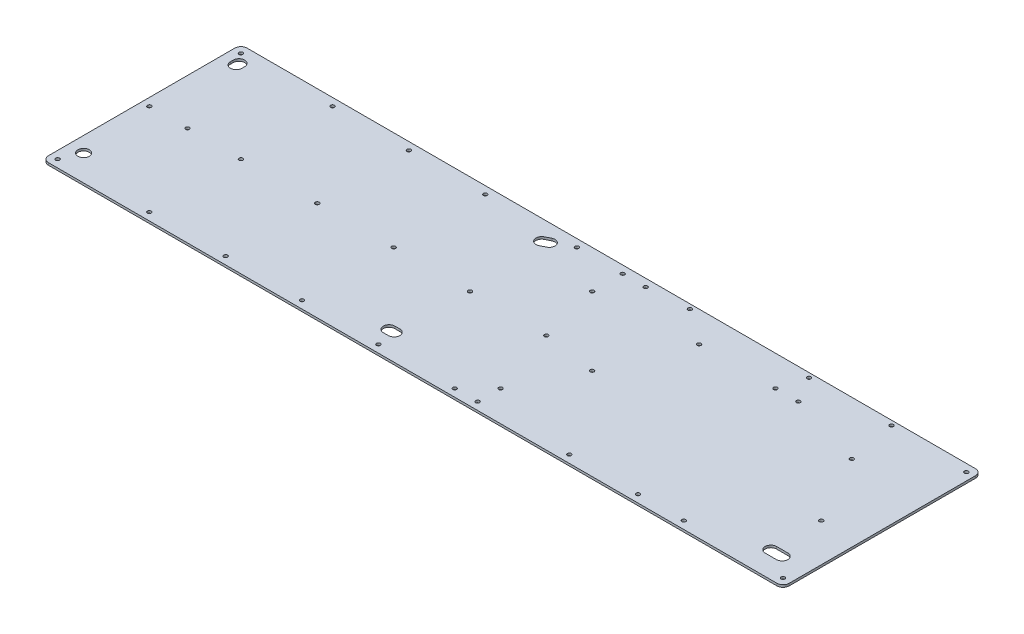
from build123d import *

# Parameters (mm, degrees)
BOSS_EXTRUDE1_START = -4
SKETCH1_W           = 485
SKETCH1_H           = 130
SKETCH1_R           = 1.25
SKETCH1_R_2         = 3.75
BOSS_EXTRUDE1_DEPTH = 1.5
FILLET1_R           = 4


with BuildPart() as part:
    # Sketch1 → Boss-Extrude1 (new body)
    with BuildSketch(Plane(origin=(0, 0, 0), x_dir=(1, 0, 0), z_dir=(0, 1, 0)).offset(BOSS_EXTRUDE1_START)):
        with Locations((242.5, 65)):
            Rectangle(SKETCH1_W, SKETCH1_H)
        with Locations(Location((5, 125, 0), (0, 0, 270))):
            Circle(SKETCH1_R, mode=Mode.SUBTRACT)
        with Locations(Location((65, 125, 0), (0, 0, 270))):
            Circle(SKETCH1_R, mode=Mode.SUBTRACT)
        with Locations(Location((5, 65, 0), (0, 0, 270))):
            Circle(SKETCH1_R, mode=Mode.SUBTRACT)
        with Locations(Location((30, 65, 0), (0, 0, 270))):
            Circle(SKETCH1_R, mode=Mode.SUBTRACT)
        with Locations(Location((65, 65, 0), (0, 0, 270))):
            Circle(SKETCH1_R, mode=Mode.SUBTRACT)
        with Locations(Location((115, 125, 0), (0, 0, 270))):
            Circle(SKETCH1_R, mode=Mode.SUBTRACT)
        with Locations(Location((115, 65, 0), (0, 0, 270))):
            Circle(SKETCH1_R, mode=Mode.SUBTRACT)
        with Locations(Location((5, 5, 0), (0, 0, 270))):
            Circle(SKETCH1_R, mode=Mode.SUBTRACT)
        with Locations(Location((65, 5, 0), (0, 0, 270))):
            Circle(SKETCH1_R, mode=Mode.SUBTRACT)
        with Locations(Location((115, 5, 0), (0, 0, 270))):
            Circle(SKETCH1_R, mode=Mode.SUBTRACT)
        with Locations(Location((165, 5, 0), (0, 0, 270))):
            Circle(SKETCH1_R, mode=Mode.SUBTRACT)
        with Locations(Location((215, 5, 0), (0, 0, 270))):
            Circle(SKETCH1_R, mode=Mode.SUBTRACT)
        with Locations(Location((265, 5, 0), (0, 0, 270))):
            Circle(SKETCH1_R, mode=Mode.SUBTRACT)
        with Locations(Location((280, 5, 0), (0, 0, 270))):
            Circle(SKETCH1_R, mode=Mode.SUBTRACT)
        with Locations(Location((280, 20, 0), (0, 0, 270))):
            Circle(SKETCH1_R, mode=Mode.SUBTRACT)
        with Locations(Location((415, 5, 0), (0, 0, 270))):
            Circle(SKETCH1_R, mode=Mode.SUBTRACT)
        with Locations(Location((385, 5, 0), (0, 0, 270))):
            Circle(SKETCH1_R, mode=Mode.SUBTRACT)
        with Locations(Location((339.996937627, 5, 0), (0, 0, 270))):
            Circle(SKETCH1_R, mode=Mode.SUBTRACT)
        with Locations(Location((480, 5, 0), (0, 0, 270))):
            Circle(SKETCH1_R, mode=Mode.SUBTRACT)
        with Locations(Location((460, 50, 0), (0, 0, 270))):
            Circle(SKETCH1_R, mode=Mode.SUBTRACT)
        with Locations(Location((435, 95, 0), (0, 0, 270))):
            Circle(SKETCH1_R, mode=Mode.SUBTRACT)
        with Locations(Location((369.997825764, 110.029448802, 0), (0, 0, 270))):
            Circle(SKETCH1_R, mode=Mode.SUBTRACT)
        with Locations(Location((385, 110.029448802, 0), (0, 0, 270))):
            Circle(SKETCH1_R, mode=Mode.SUBTRACT)
        with Locations(Location((480, 125, 0), (0, 0, 270))):
            Circle(SKETCH1_R, mode=Mode.SUBTRACT)
        with Locations(Location((429, 127, 0), (0, 0, 270))):
            Circle(SKETCH1_R, mode=Mode.SUBTRACT)
        with Locations(Location((374.95, 127, 0), (0, 0, 270))):
            Circle(SKETCH1_R, mode=Mode.SUBTRACT)
        with Locations(Location((300, 60, 0), (0, 0, 270))):
            Circle(SKETCH1_R, mode=Mode.SUBTRACT)
        with Locations(Location((265, 65, 0), (0, 0, 270))):
            Circle(SKETCH1_R, mode=Mode.SUBTRACT)
        with Locations(Location((255, 105, 0), (0, 0, 270))):
            Circle(SKETCH1_R, mode=Mode.SUBTRACT)
        with Locations(Location((320, 110, 0), (0, 0, 270))):
            Circle(SKETCH1_R, mode=Mode.SUBTRACT)
        with Locations(Location((297, 127, 0), (0, 0, 270))):
            Circle(SKETCH1_R, mode=Mode.SUBTRACT)
        with Locations(Location((270, 125, 0), (0, 0, 270))):
            Circle(SKETCH1_R, mode=Mode.SUBTRACT)
        with Locations(Location((255, 125, 0), (0, 0, 270))):
            Circle(SKETCH1_R, mode=Mode.SUBTRACT)
        with Locations(Location((215, 65, 0), (0, 0, 270))):
            Circle(SKETCH1_R, mode=Mode.SUBTRACT)
        with Locations(Location((165, 65, 0), (0, 0, 270))):
            Circle(SKETCH1_R, mode=Mode.SUBTRACT)
        with Locations(Location((165, 125, 0), (0, 0, 270))):
            Circle(SKETCH1_R, mode=Mode.SUBTRACT)
        with Locations(Location((10, 17, 0), (0, 0, 270))):
            Circle(SKETCH1_R_2, mode=Mode.SUBTRACT)
        with Locations(Location((225, 125, 0), (0, 0, 270))):
            Circle(SKETCH1_R, mode=Mode.SUBTRACT)
        with BuildLine():
            Line((13.75, 118.712635694), (13.75, 116.888420957))
            ThreePointArc((13.75, 116.888420957), (10, 113.138420957), (6.25, 116.888420957))
            Line((6.25, 116.888420957), (6.25, 118.712635694))
            ThreePointArc((6.25, 118.712635694), (10, 122.462635694), (13.75, 118.712635694))
        make_face(mode=Mode.SUBTRACT)
        with BuildLine():
            Line((214.979714971, 115.245673576), (211.665232202, 113.589272725))
            ThreePointArc((211.665232202, 113.589272725), (206.634419623, 115.267344473), (208.312491372, 120.298157053))
            Line((208.312491372, 120.298157053), (211.626974141, 121.954557904))
            ThreePointArc((211.626974141, 121.954557904), (216.65778672, 120.276486155), (214.979714971, 115.245673576))
        make_face(mode=Mode.SUBTRACT)
        with BuildLine():
            Line((209.988861787, 20.75), (213.303344556, 20.75))
            ThreePointArc((213.303344556, 20.75), (217.053344556, 17), (213.303344556, 13.25))
            Line((213.303344556, 13.25), (209.988861787, 13.25))
            ThreePointArc((209.988861787, 13.25), (206.238861787, 17), (209.988861787, 20.75))
        make_face(mode=Mode.SUBTRACT)
        with BuildLine():
            Line((467.376612972, 13.25), (460, 13.25))
            ThreePointArc((460, 13.25), (456.25, 17), (460, 20.75))
            Line((460, 20.75), (467.376612972, 20.75))
            ThreePointArc((467.376612972, 20.75), (471.126612972, 17), (467.376612972, 13.25))
        make_face(mode=Mode.SUBTRACT)
    extrude(amount=-BOSS_EXTRUDE1_DEPTH)

    # Fillet1
    fillet1_edges = [part.edges().sort_by_distance(p)[0] for p in [
        (485, -4.75, 0),
        (0, -4.75, 0),
        (0, -4.75, -130),
        (485, -4.75, -130),
    ]]
    fillet(fillet1_edges, radius=FILLET1_R)


solid = part.part
